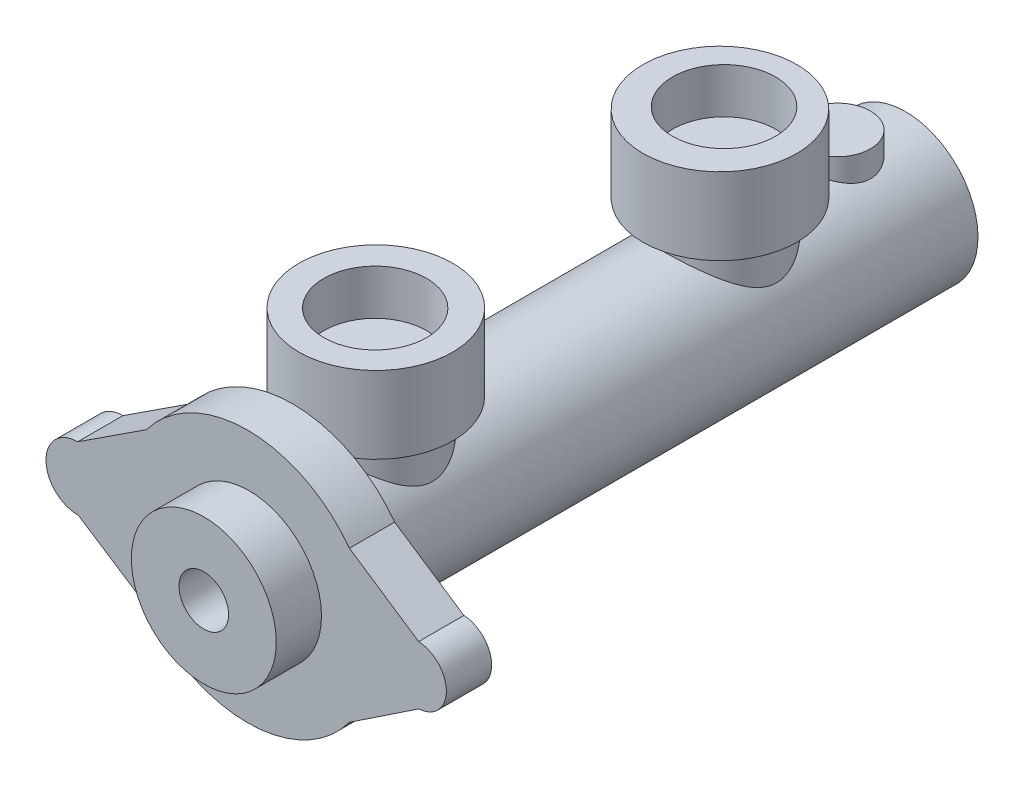
from build123d import *

# Parameters (mm, degrees)
SKIZZE1_R                       = 16
AUFSATZ_LINEAR_AUSTRAGEN1_DEPTH = 135
SKIZZE2_R                       = 7.25
AUFSATZ_LINEAR_AUSTRAGEN2_DEPTH = 20
SKIZZE4_R                       = 12.5
AUFSATZ_LINEAR_AUSTRAGEN3_DEPTH = 20
SKIZZE7_R                       = 16
AUFSATZ_LINEAR_AUSTRAGEN4_DEPTH = 10
SKIZZE8_R                       = 17
AUFSATZ_LINEAR_AUSTRAGEN5_DEPTH = 17
SKIZZE9_R                       = 11.376613665
SKIZZE9_R_2                     = 11.354918218
SCHNITT_LINEAR_AUSTRAGEN2_DEPTH = 10
SKIZZE10_R                      = 16
AUFSATZ_LINEAR_AUSTRAGEN6_DEPTH = 20
SKIZZE11_R                      = 5.479403349
SCHNITT_LINEAR_AUSTRAGEN3_DEPTH = 20


with BuildPart() as part:
    # Skizze1 → Aufsatz-Linear austragen1 (new body)
    with BuildSketch(Plane.XY):
        Circle(SKIZZE1_R)
    extrude(amount=AUFSATZ_LINEAR_AUSTRAGEN1_DEPTH)

    # Skizze2 → Aufsatz-Linear austragen2 (add)
    with BuildSketch(Plane(origin=(0, 0, 0), x_dir=(1, 0, 0), z_dir=(0, 1, 0))):
        with Locations(Location((0, -15, 0), (0, 0, 90))):
            Circle(SKIZZE2_R)
    extrude(amount=AUFSATZ_LINEAR_AUSTRAGEN2_DEPTH)

    # Skizze4 → Aufsatz-Linear austragen3 (add)
    with BuildSketch(Plane(origin=(0, 0, 0), x_dir=(1, 0, 0), z_dir=(0, 1, 0))):
        with Locations(Location((0, -41, 0), (0, 0, 90))):
            Circle(SKIZZE4_R)
        with Locations(Location((0, -117, 0), (0, 0, 90))):
            Circle(SKIZZE4_R)
    extrude(amount=AUFSATZ_LINEAR_AUSTRAGEN3_DEPTH)

    # Skizze8 → Aufsatz-Linear austragen5 (add)
    with BuildSketch(Plane(origin=(0, 20, 0), x_dir=(1, 0, 0), z_dir=(0, 1, 0))):
        with Locations(Location((0, -41, 0), (0, 0, 270))):
            Circle(SKIZZE8_R)
        with Locations(Location((0, -117, 0), (0, 0, 270))):
            Circle(SKIZZE8_R)
    extrude(amount=AUFSATZ_LINEAR_AUSTRAGEN5_DEPTH)

    # Skizze9 → Schnitt-Linear austragen2 (cut)
    with BuildSketch(Plane(origin=(0, 37, 0), x_dir=(1, 0, 0), z_dir=(0, 1, 0))):
        with Locations(Location((0, -40.087207053, 0), (0, 0, 270))):
            Circle(SKIZZE9_R)
        with Locations(Location((0, -117.14037352, 0), (0, 0, 270))):
            Circle(SKIZZE9_R_2)
    extrude(amount=-SCHNITT_LINEAR_AUSTRAGEN2_DEPTH, mode=Mode.SUBTRACT)



with BuildPart() as body_2:
    # Skizze7 → Aufsatz-Linear austragen4 (new body)
    with BuildSketch(Plane.XY.offset(135)):
        with BuildLine():
            Line((22.150629915, -17.24109716), (37.5, -7))
            ThreePointArc((37.5, -7), (43.58064746, -0.550964854), (37.446578261, 5.847278882))
            Line((37.446578261, 5.847278882), (22.167008351, 16.063537827))
            ThreePointArc((22.167008351, 16.063537827), (-0.191707942, 27.421836078), (-22.678353656, 16.318958162))
            Line((-22.678353656, 16.318958162), (-37.851181588, 6.422290222))
            ThreePointArc((-37.851181588, 6.422290222), (-44.850742391, -0.656122578), (-37.694365828, -7.575953044))
            Line((-37.694365828, -7.575953044), (-22.830978008, -17.270784777))
            ThreePointArc((-22.830978008, -17.270784777), (-0.332701744, -28.57770368), (22.150629915, -17.24109716))
        make_face()
        Circle(SKIZZE7_R, mode=Mode.SUBTRACT)
    extrude(amount=AUFSATZ_LINEAR_AUSTRAGEN4_DEPTH)


with BuildPart() as part_1:
    add(part.part)

    add(body_2.part)  # Aufsatz-Linear austragen6 merges body 2
    # Skizze10 → Aufsatz-Linear austragen6 (add)
    with BuildSketch(Plane.XY.offset(135)):
        Circle(SKIZZE10_R)
    extrude(amount=AUFSATZ_LINEAR_AUSTRAGEN6_DEPTH)

    # Skizze11 → Schnitt-Linear austragen3 (cut)
    with BuildSketch(Plane.XY.offset(155)):
        Circle(SKIZZE11_R)
    extrude(amount=-SCHNITT_LINEAR_AUSTRAGEN3_DEPTH, mode=Mode.SUBTRACT)


solid = part_1.part
